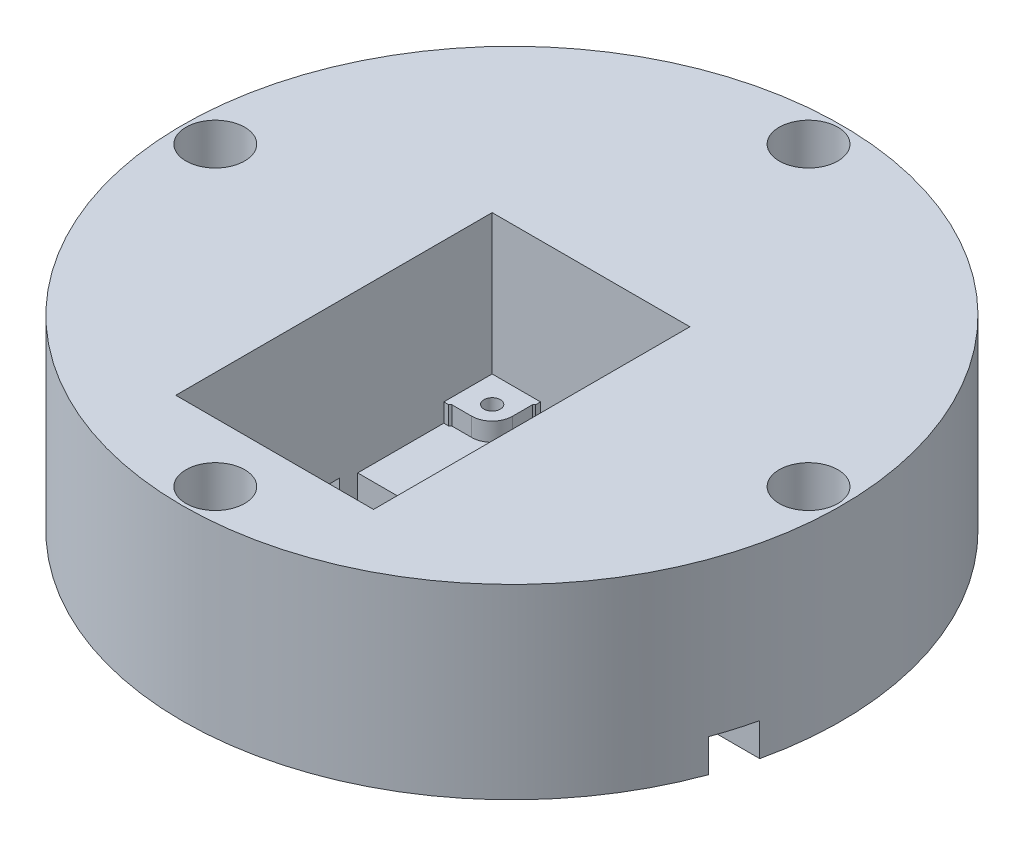
from build123d import *

# Parameters (mm, degrees)
SKETCH_1_R                = 95
EXTRUDE_1_DEPTH           = 20
CUT_EXTRUDE_1_DEPTH       = 10
CUT_EXTRUDE_3_DEPTH       = 136.830777072
CUT_EXTRUDE_3_DEPTH_BACK  = 136.830777072
SKETCH_3_3_R              = 1.25
CUT_EXTRUDE_4_DEPTH       = 136.830777072
CUT_EXTRUDE_4_DEPTH_BACK  = 7.2
SKETCH_3_4_R              = 1.25
SKETCH_4_R                = 2.4
CUT_EXTRUDE_5_DEPTH       = 2.6
SKETCH_5_R                = 4
CUT_EXTRUDE_6_DEPTH       = 136.830777072
SKETCH_6_W                = 30
SKETCH_6_H                = 11.5
CUT_EXTRUDE_7_DEPTH       = 136.830777072
EXTRUDE_START             = 1.3
SKETCH_7_R                = 95
SKETCH_7_R_2              = 4
SKETCH_7_R_3              = 2.4
SKETCH_7_W                = 30
SKETCH_7_H                = 11.5
EXTRUDE_2_DEPTH           = 1.3
SKETCH_8_R                = 2.4
SKETCH_8_R_2              = 1.25
EXTRUDE_3_DEPTH           = 1.3
CUT_EXTRUDE_8_DEPTH       = 6.5
SKETCH_10_R               = 95
SKETCH_10_R_2             = 4
SKETCH_10_R_3             = 50
CUT_EXTRUDE_9_DEPTH       = 137.028269121
SKETCH_11_R               = 2.5
CUT_EXTRUDE_10_DEPTH      = 74.849102906
SKETCH_12_R               = 4.45
CUT_EXTRUDE_11_DEPTH      = 6.3
EXTRUDE_START_2           = 24
SKETCH_13_R               = 50
SKETCH_13_R_2             = 2.5
SKETCH_13_W               = 30
SKETCH_13_H               = 48
EXTRUDE_4_DEPTH           = 24
CUT_EXTRUDE_START         = -7
SKETCH_14_R               = 50
CUT_EXTRUDE_12_DEPTH      = 7
SKETCH_17_R               = 2.4
CUT_EXTRUDE_14_DEPTH      = 2.6
SKETCH_18_W               = 97.481844464
SKETCH_18_H               = 6
CUT_EXTRUDE_15_DEPTH      = 5
SKETCH_19_R               = 50
CUT_EXTRUDE_16_DEPTH      = 10
CUT_EXTRUDE_17_DEPTH      = 6.3
CUT_EXTRUDE_17_DEPTH_BACK = 73.284161474
SKETCH_20_R               = 4.45


with BuildPart() as part:
    # 스케치1 → 보스-돌출1 (new body)
    with BuildSketch(Plane(origin=(0, 0, 0), x_dir=(1, 0, 0), z_dir=(0, 1, 0))):
        Circle(SKETCH_1_R)
    extrude(amount=EXTRUDE_1_DEPTH)

    # 스케치3 → 컷-돌출1 (cut)
    with BuildSketch(Plane(origin=(0, 20, 0), x_dir=(1, 0, 0), z_dir=(0, 1, 0))):
        with BuildLine():
            Line((7.662132034, 12), (-7.662132034, 12))
            Line((-7.662132034, 12), (-7.662132034, 11.25))
            Line((-7.662132034, 11.25), (-7.9, 11.012132034))
            Line((-7.9, 11.012132034), (-7.9, 8))
            ThreePointArc((-7.9, 8), (-7.904885858, 7.826021708), (-7.91952803, 7.652591824))
            ThreePointArc((-7.91952803, 7.652591824), (-8.492918139, 6.176667737), (-9.720374371, 5.176428104))
            ThreePointArc((-9.720374371, 5.176428104), (-10.345428719, 4.969894979), (-11, 4.9))
            Line((-11, 4.9), (-14.012132034, 4.9))
            Line((-14.012132034, 4.9), (-14.25, 4.662132034))
            Line((-14.25, 4.662132034), (-15, 4.662132034))
            Line((-15, 4.662132034), (-15, -28.662132034))
            Line((-15, -28.662132034), (-14.25, -28.662132034))
            Line((-14.25, -28.662132034), (-14.012132034, -28.9))
            Line((-14.012132034, -28.9), (-11, -28.9))
            ThreePointArc((-11, -28.9), (-8.807968978, -29.807968978), (-7.9, -32))
            Line((-7.9, -32), (-7.9, -35.012132034))
            Line((-7.9, -35.012132034), (-7.662132034, -35.25))
            Line((-7.662132034, -35.25), (-7.662132034, -36))
            Line((-7.662132034, -36), (7.662132034, -36))
            Line((7.662132034, -36), (7.662132034, -35.25))
            Line((7.662132034, -35.25), (7.9, -35.012132034))
            Line((7.9, -35.012132034), (7.9, -32))
            ThreePointArc((7.9, -32), (8.807968978, -29.807968978), (11, -28.9))
            Line((11, -28.9), (14.012132034, -28.9))
            Line((14.012132034, -28.9), (14.25, -28.662132034))
            Line((14.25, -28.662132034), (15, -28.662132034))
            Line((15, -28.662132034), (15, 4.662132034))
            Line((15, 4.662132034), (14.25, 4.662132034))
            Line((14.25, 4.662132034), (14.012132034, 4.9))
            Line((14.012132034, 4.9), (11, 4.9))
            ThreePointArc((11, 4.9), (10.345428719, 4.969894979), (9.720374371, 5.176428104))
            ThreePointArc((9.720374371, 5.176428104), (8.492918139, 6.176667737), (7.91952803, 7.652591824))
            ThreePointArc((7.91952803, 7.652591824), (7.904885858, 7.826021708), (7.9, 8))
            Line((7.9, 8), (7.9, 11.012132034))
            Line((7.9, 11.012132034), (7.662132034, 11.25))
            Line((7.662132034, 11.25), (7.662132034, 12))
        make_face()
    extrude(amount=-CUT_EXTRUDE_1_DEPTH, mode=Mode.SUBTRACT)

    # 스케치3<3> → 컷-돌출3 (cut, two sides: drawn at the far end of the back side and taken through both)
    with BuildSketch(Plane(origin=(0, 20, 0), x_dir=(1, 0, 0), z_dir=(0, 1, 0)).offset(-CUT_EXTRUDE_3_DEPTH_BACK)):
        with Locations((-11, 8)):
            Circle(SKETCH_3_3_R)
        with Locations((11, 8)):
            Circle(SKETCH_3_3_R)
        with Locations((-11, -32)):
            Circle(SKETCH_3_3_R)
        with Locations((11, -32.000000001)):
            Circle(SKETCH_3_3_R)
    extrude(amount=CUT_EXTRUDE_3_DEPTH + CUT_EXTRUDE_3_DEPTH_BACK, mode=Mode.SUBTRACT)

    # 스케치3<4> → 컷-돌출4 (cut, two sides: drawn at the far end of the back side and taken through both)
    # profile 1 of 4: a face of its own
    with BuildSketch(Plane(origin=(0, 20, 0), x_dir=(1, 0, 0), z_dir=(0, 1, 0)).offset(-CUT_EXTRUDE_4_DEPTH_BACK)):
        with BuildLine():
            Line((-7.662132034, 12), (-15, 12))
            Line((-15, 12), (-15, 4.662132034))
            Line((-15, 4.662132034), (-14.25, 4.662132034))
            Line((-14.25, 4.662132034), (-14.012132034, 4.9))
            Line((-14.012132034, 4.9), (-11, 4.9))
            ThreePointArc((-11, 4.9), (-8.807968978, 5.807968978), (-7.9, 8))
            Line((-7.9, 8), (-7.9, 11.012132034))
            Line((-7.9, 11.012132034), (-7.662132034, 11.25))
            Line((-7.662132034, 11.25), (-7.662132034, 12))
        make_face()
        with Locations((-11, 8)):
            Circle(SKETCH_3_4_R, mode=Mode.SUBTRACT)
    # profile 2 of 4: a face of its own
    with BuildSketch(Plane(origin=(0, 20, 0), x_dir=(1, 0, 0), z_dir=(0, 1, 0)).offset(-CUT_EXTRUDE_4_DEPTH_BACK)):
        with BuildLine():
            Line((15, 12), (7.662132034, 12))
            Line((7.662132034, 12), (7.662132034, 11.25))
            Line((7.662132034, 11.25), (7.9, 11.012132034))
            Line((7.9, 11.012132034), (7.9, 8))
            ThreePointArc((7.9, 8), (8.807968978, 5.807968978), (11, 4.9))
            Line((11, 4.9), (14.012132034, 4.9))
            Line((14.012132034, 4.9), (14.25, 4.662132034))
            Line((14.25, 4.662132034), (15, 4.662132034))
            Line((15, 4.662132034), (15, 12))
        make_face()
        with Locations((11, 8)):
            Circle(SKETCH_3_4_R, mode=Mode.SUBTRACT)
    # profile 3 of 4: a face of its own
    with BuildSketch(Plane(origin=(0, 20, 0), x_dir=(1, 0, 0), z_dir=(0, 1, 0)).offset(-CUT_EXTRUDE_4_DEPTH_BACK)):
        with BuildLine():
            Line((-14.25, -28.662132034), (-15, -28.662132034))
            Line((-15, -28.662132034), (-15, -36))
            Line((-15, -36), (-7.662132034, -36))
            Line((-7.662132034, -36), (-7.662132034, -35.25))
            Line((-7.662132034, -35.25), (-7.9, -35.012132034))
            Line((-7.9, -35.012132034), (-7.9, -32))
            ThreePointArc((-7.9, -32), (-8.807968978, -29.807968978), (-11, -28.9))
            Line((-11, -28.9), (-14.012132034, -28.9))
            Line((-14.012132034, -28.9), (-14.25, -28.662132034))
        make_face()
        with Locations((-11, -32)):
            Circle(SKETCH_3_4_R, mode=Mode.SUBTRACT)
    # profile 4 of 4: a face of its own
    with BuildSketch(Plane(origin=(0, 20, 0), x_dir=(1, 0, 0), z_dir=(0, 1, 0)).offset(-CUT_EXTRUDE_4_DEPTH_BACK)):
        with BuildLine():
            Line((15, -36), (15, -28.662132034))
            Line((15, -28.662132034), (14.25, -28.662132034))
            Line((14.25, -28.662132034), (14.012132034, -28.9))
            Line((14.012132034, -28.9), (11, -28.9))
            ThreePointArc((11, -28.9), (8.807968978, -29.807968978), (7.9, -32))
            Line((7.9, -32), (7.9, -35.012132034))
            Line((7.9, -35.012132034), (7.662132034, -35.25))
            Line((7.662132034, -35.25), (7.662132034, -36))
            Line((7.662132034, -36), (15, -36))
        make_face()
        with Locations((11, -32.000000001)):
            Circle(SKETCH_3_4_R, mode=Mode.SUBTRACT)
    extrude(amount=CUT_EXTRUDE_4_DEPTH + CUT_EXTRUDE_4_DEPTH_BACK, mode=Mode.SUBTRACT)

    # 스케치4 → 컷-돌출5 (cut)
    with BuildSketch(Plane.XZ):
        with Locations((11, -8)):
            Circle(SKETCH_4_R)
        with Locations((10.9999909, 32.000014521)):
            Circle(SKETCH_4_R)
        with Locations((-11, -8)):
            Circle(SKETCH_4_R)
        with Locations((-11.0000091, 32.000014521)):
            Circle(SKETCH_4_R)
    extrude(amount=-CUT_EXTRUDE_5_DEPTH, mode=Mode.SUBTRACT)

    # 스케치5 → 컷-돌출6 (cut, through all)
    with BuildSketch(Plane.XZ):
        with Locations((86, 0)):
            Circle(SKETCH_5_R)
        with Locations((0, -86)):
            Circle(SKETCH_5_R)
        with Locations((-86, 0)):
            Circle(SKETCH_5_R)
        with Locations((0, 86)):
            Circle(SKETCH_5_R)
    extrude(amount=-CUT_EXTRUDE_6_DEPTH, mode=Mode.SUBTRACT)

    # 스케치6 → 컷-돌출7 (cut, through all)
    with BuildSketch(Plane(origin=(0, 0, 0), x_dir=(1, 0, 0), z_dir=(0, 1, 0))):
        with Locations((0, -14.15)):
            Rectangle(SKETCH_6_W, SKETCH_6_H)
    extrude(amount=CUT_EXTRUDE_7_DEPTH, mode=Mode.SUBTRACT)

    # 스케치7 → 보스-돌출2 (add)
    with BuildSketch(Plane.XZ.offset(EXTRUDE_START)):
        Circle(SKETCH_7_R)
        with Locations((-86, 0)):
            Circle(SKETCH_7_R_2, mode=Mode.SUBTRACT)
        with Locations((0, 86)):
            Circle(SKETCH_7_R_2, mode=Mode.SUBTRACT)
        with Locations((86, 0)):
            Circle(SKETCH_7_R_2, mode=Mode.SUBTRACT)
        with Locations((0, -86)):
            Circle(SKETCH_7_R_2, mode=Mode.SUBTRACT)
        with Locations((11, -8)):
            Circle(SKETCH_7_R_3, mode=Mode.SUBTRACT)
        with Locations((-11, -8)):
            Circle(SKETCH_7_R_3, mode=Mode.SUBTRACT)
        with Locations((-11.0000091, 32.000014521)):
            Circle(SKETCH_7_R_3, mode=Mode.SUBTRACT)
        with Locations((10.9999909, 32.000014521)):
            Circle(SKETCH_7_R_3, mode=Mode.SUBTRACT)
        with Locations((0, 14.15)):
            Rectangle(SKETCH_7_W, SKETCH_7_H, mode=Mode.SUBTRACT)
    extrude(amount=-EXTRUDE_2_DEPTH)

    # 스케치8 → 보스-돌출3 (add)
    # profile 1 of 4: a face of its own
    with BuildSketch(Plane.XZ.offset(-2.6)):
        with Locations((-11, -8)):
            Circle(SKETCH_8_R)
        with Locations((-11, -8)):
            Circle(SKETCH_8_R_2, mode=Mode.SUBTRACT)
    # profile 2 of 4: a face of its own
    with BuildSketch(Plane.XZ.offset(-2.6)):
        with Locations((11, -8)):
            Circle(SKETCH_8_R)
        with Locations((11, -8)):
            Circle(SKETCH_8_R_2, mode=Mode.SUBTRACT)
    # profile 3 of 4: a face of its own
    with BuildSketch(Plane.XZ.offset(-2.6)):
        with Locations((10.9999909, 32.000014521)):
            Circle(SKETCH_8_R)
        with Locations((11, 32.000000001)):
            Circle(SKETCH_8_R_2, mode=Mode.SUBTRACT)
    # profile 4 of 4: a face of its own
    with BuildSketch(Plane.XZ.offset(-2.6)):
        with Locations((-11.0000091, 32.000014521)):
            Circle(SKETCH_8_R)
        with Locations((-11, 32)):
            Circle(SKETCH_8_R_2, mode=Mode.SUBTRACT)
    extrude(amount=EXTRUDE_3_DEPTH)

    # 스케치9 → 컷-돌출8 (cut)
    with BuildSketch(Plane.XZ.offset(1.3)):
        Polygon((7.5, 86), (3.75, 92.495190528), (-3.75, 92.495190528), (-7.5, 86), (-3.75, 79.504809472), (3.75, 79.504809472), align=None)
        Polygon((-86, 7.5), (-92.495190528, 3.75), (-92.495190528, -3.75), (-86, -7.5), (-79.504809472, -3.75), (-79.504809472, 3.75), align=None)
        Polygon((86, -7.5), (92.495190528, -3.75), (92.495190528, 3.75), (86, 7.5), (79.504809472, 3.75), (79.504809472, -3.75), align=None)
        Polygon((-7.5, -86), (-3.75, -92.495190528), (3.75, -92.495190528), (7.5, -86), (3.75, -79.504809472), (-3.75, -79.504809472), align=None)
    extrude(amount=-CUT_EXTRUDE_8_DEPTH, mode=Mode.SUBTRACT)

    # 스케치10 → 컷-돌출9 (cut, through all)
    with BuildSketch(Plane(origin=(0, 20, 0), x_dir=(1, 0, 0), z_dir=(0, 1, 0))):
        Circle(SKETCH_10_R)
        with Locations((0, -86)):
            Circle(SKETCH_10_R_2, mode=Mode.SUBTRACT)
        with Locations((-86, 0)):
            Circle(SKETCH_10_R_2, mode=Mode.SUBTRACT)
        Circle(SKETCH_10_R_3, mode=Mode.SUBTRACT)
        with Locations((86, 0)):
            Circle(SKETCH_10_R_2, mode=Mode.SUBTRACT)
        with Locations((0, 86)):
            Circle(SKETCH_10_R_2, mode=Mode.SUBTRACT)
    extrude(amount=-CUT_EXTRUDE_9_DEPTH, mode=Mode.SUBTRACT)

    # 스케치11 → 컷-돌출10 (cut, through all)
    with BuildSketch(Plane(origin=(0, 20, 0), x_dir=(1, 0, 0), z_dir=(0, 1, 0))):
        with Locations((0, 45)):
            Circle(SKETCH_11_R)
        with Locations((45, 0)):
            Circle(SKETCH_11_R)
        with Locations((0, -45)):
            Circle(SKETCH_11_R)
        with Locations((-45, 0)):
            Circle(SKETCH_11_R)
    extrude(amount=-CUT_EXTRUDE_10_DEPTH, mode=Mode.SUBTRACT)

    # 스케치12 → 컷-돌출11 (cut)
    with BuildSketch(Plane.XZ.offset(1.3)):
        with Locations((0, -45)):
            Circle(SKETCH_12_R)
        with Locations((-45, 0)):
            Circle(SKETCH_12_R)
        with Locations((0, 45)):
            Circle(SKETCH_12_R)
        with Locations((45, 0)):
            Circle(SKETCH_12_R)
    extrude(amount=-CUT_EXTRUDE_11_DEPTH, mode=Mode.SUBTRACT)

    # 스케치13 → 보스-돌출4 (add)
    with BuildSketch(Plane(origin=(0, 20, 0), x_dir=(1, 0, 0), z_dir=(0, 1, 0)).offset(EXTRUDE_START_2)):
        Circle(SKETCH_13_R)
        with Locations((0, 45)):
            Circle(SKETCH_13_R_2, mode=Mode.SUBTRACT)
        with Locations((-45, 0)):
            Circle(SKETCH_13_R_2, mode=Mode.SUBTRACT)
        with Locations((0, -45)):
            Circle(SKETCH_13_R_2, mode=Mode.SUBTRACT)
        with Locations((45, 0)):
            Circle(SKETCH_13_R_2, mode=Mode.SUBTRACT)
        with Locations((0, -12)):
            Rectangle(SKETCH_13_W, SKETCH_13_H, mode=Mode.SUBTRACT)
    extrude(amount=-EXTRUDE_4_DEPTH)

    # 스케치14 → 컷-돌출12 (cut)
    with BuildSketch(Plane.XZ.offset(1.3).offset(CUT_EXTRUDE_START)):
        Circle(SKETCH_14_R)
    extrude(amount=CUT_EXTRUDE_12_DEPTH, mode=Mode.SUBTRACT)

    # 스케치17 → 컷-돌출14 (cut)
    with BuildSketch(Plane.XZ.offset(-5.7)):
        with Locations((11, -8)):
            Circle(SKETCH_17_R)
        with Locations((-11, -8)):
            Circle(SKETCH_17_R)
        with Locations((-11, 32)):
            Circle(SKETCH_17_R)
        with Locations((11, 32.000000001)):
            Circle(SKETCH_17_R)
    extrude(amount=-CUT_EXTRUDE_14_DEPTH, mode=Mode.SUBTRACT)

    # 스케치18 → 컷-돌출15 (cut)
    with BuildSketch(Plane.XZ.offset(-5.7)):
        with Locations((0, 14.15)):
            Rectangle(SKETCH_18_W, SKETCH_18_H)
    extrude(amount=-CUT_EXTRUDE_15_DEPTH, mode=Mode.SUBTRACT)

    # 스케치19 → 컷-돌출16 (cut)
    with BuildSketch(Plane(origin=(0, 44, 0), x_dir=(1, 0, 0), z_dir=(0, 1, 0))):
        Circle(SKETCH_19_R)
    extrude(amount=-CUT_EXTRUDE_16_DEPTH, mode=Mode.SUBTRACT)

    # 스케치20 → 컷-돌출17 (cut, two sides: drawn at the far end of the back side and taken through both)
    with BuildSketch(Plane(origin=(0, 20.7, 0), x_dir=(-1, 0, 0), z_dir=(0, -1, 0)).offset(-CUT_EXTRUDE_17_DEPTH_BACK)):
        with Locations((-45, 0)):
            Circle(SKETCH_20_R)
        with Locations((0, -45)):
            Circle(SKETCH_20_R)
        with Locations((45, 0)):
            Circle(SKETCH_20_R)
        with Locations((0, 45)):
            Circle(SKETCH_20_R)
    extrude(amount=CUT_EXTRUDE_17_DEPTH + CUT_EXTRUDE_17_DEPTH_BACK, mode=Mode.SUBTRACT)


solid = part.part
